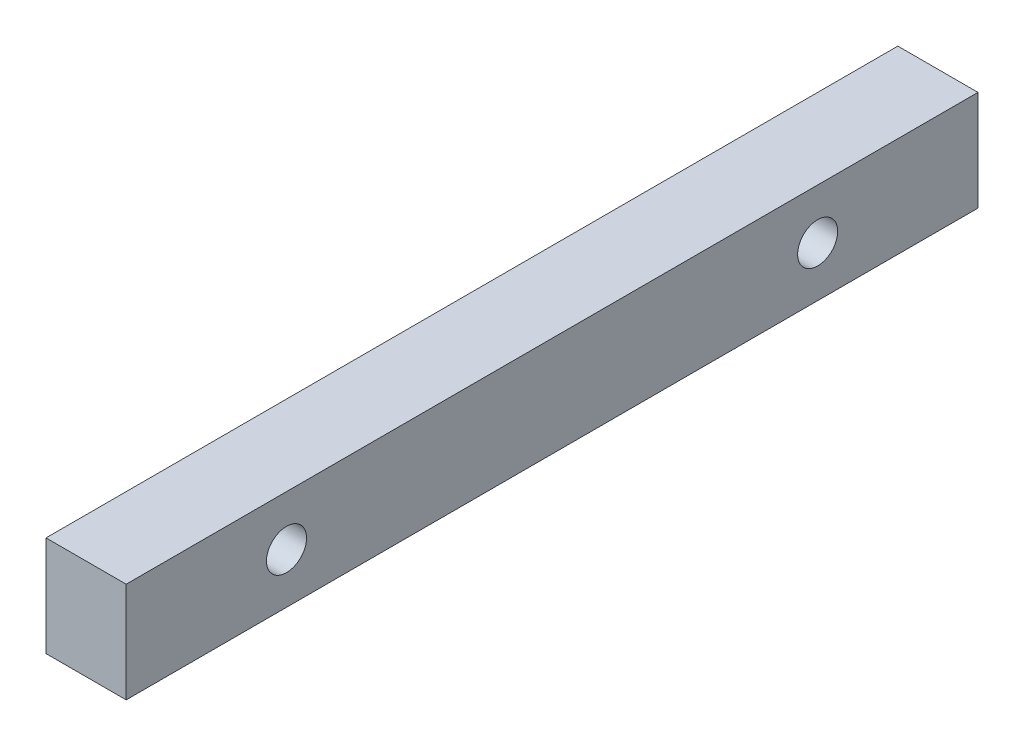
from build123d import *

# Parameters (mm, degrees)
SKETCH_1_W          = 40
SKETCH_1_H          = 50
EXTRUDE_1_DEPTH     = 212.5
CUT_EXTRUDE_1_REACH = 220.303
SKETCH_2_R          = 10


with BuildPart() as part:
    # 草图1 → 凸台-拉伸1 (new, symmetric)
    with BuildSketch(Plane.XY):
        with Locations((10, 5)):
            Rectangle(SKETCH_1_W, SKETCH_1_H)
    extrude(amount=EXTRUDE_1_DEPTH, both=True)

    # 草图2 → 切除-拉伸1 (cut, up to next)
    with BuildSketch(Plane(origin=(30, 0, 0), x_dir=(0, 0, -1), z_dir=(1, 0, 0)), mode=Mode.PRIVATE) as cut_extrude_1_sk1:
        with Locations((-132.5, 5)):
            Circle(SKETCH_2_R)
    cut_extrude_1_tool1 = extrude(cut_extrude_1_sk1.sketch, amount=-CUT_EXTRUDE_1_REACH, mode=Mode.PRIVATE) & part.part
    # 草图2 → 切除-拉伸1 (cut, up to next)
    with BuildSketch(Plane(origin=(30, 0, 0), x_dir=(0, 0, -1), z_dir=(1, 0, 0)), mode=Mode.PRIVATE) as cut_extrude_1_sk2:
        with Locations((132.5, 5)):
            Circle(SKETCH_2_R)
    cut_extrude_1_tool2 = extrude(cut_extrude_1_sk2.sketch, amount=-CUT_EXTRUDE_1_REACH, mode=Mode.PRIVATE) & part.part
    add(cut_extrude_1_tool1.solids().sort_by_distance((30, 5, 132.5))[0], mode=Mode.SUBTRACT)
    add(cut_extrude_1_tool2.solids().sort_by_distance((30, 5, -132.5))[0], mode=Mode.SUBTRACT)


solid = part.part
